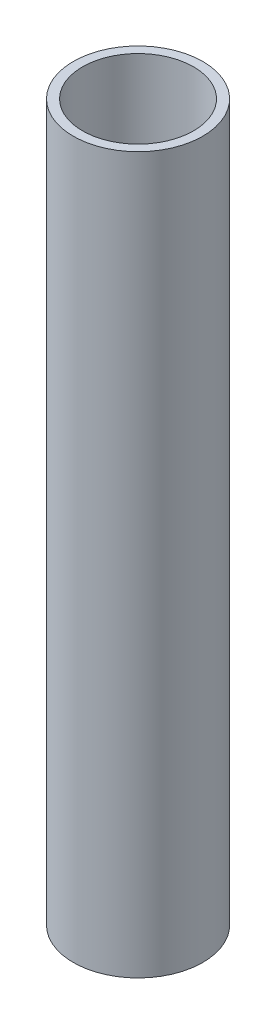
from build123d import *

# Parameters (mm, degrees)
SKETCH1_R           = 21
SKETCH1_R_2         = 18
BOSS_EXTRUDE1_DEPTH = 232


with BuildPart() as part:
    # Sketch1 → Boss-Extrude1 (new body)
    with BuildSketch(Plane(origin=(0, 0, 0), x_dir=(1, 0, 0), z_dir=(0, 1, 0))):
        with Locations(Location((0, 0, 0), (0, 0, 90))):
            Circle(SKETCH1_R)
        with Locations(Location((0, 0, 0), (0, 0, 90))):
            Circle(SKETCH1_R_2, mode=Mode.SUBTRACT)
    extrude(amount=BOSS_EXTRUDE1_DEPTH)


solid = part.part
